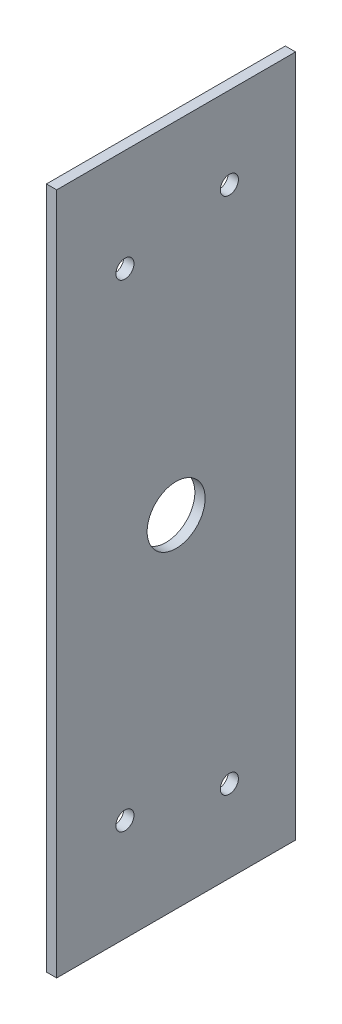
from build123d import *

# Parameters (mm, degrees)
SKETCH1_W           = 200
SKETCH1_H           = 70
SKETCH1_R           = 2.65
SKETCH1_R_2         = 8.5
BOSS_EXTRUDE1_DEPTH = 3


with BuildPart() as part:
    # Sketch1 → Boss-Extrude1 (new body)
    with BuildSketch(Plane.YZ):
        Rectangle(SKETCH1_W, SKETCH1_H)
        with Locations(Location((-76, -15.6, 0), (0, 0, 270))):
            Circle(SKETCH1_R, mode=Mode.SUBTRACT)
        with Locations(Location((76, -15.6, 0), (0, 0, 90))):
            Circle(SKETCH1_R, mode=Mode.SUBTRACT)
        with Locations(Location((-70, 15, 0), (0, 0, 270))):
            Circle(SKETCH1_R, mode=Mode.SUBTRACT)
        with Locations(Location((70, 15, 0), (0, 0, 90))):
            Circle(SKETCH1_R, mode=Mode.SUBTRACT)
        with Locations(Location((0, 0, 0), (0, 0, 270))):
            Circle(SKETCH1_R_2, mode=Mode.SUBTRACT)
    extrude(amount=BOSS_EXTRUDE1_DEPTH)


solid = part.part
